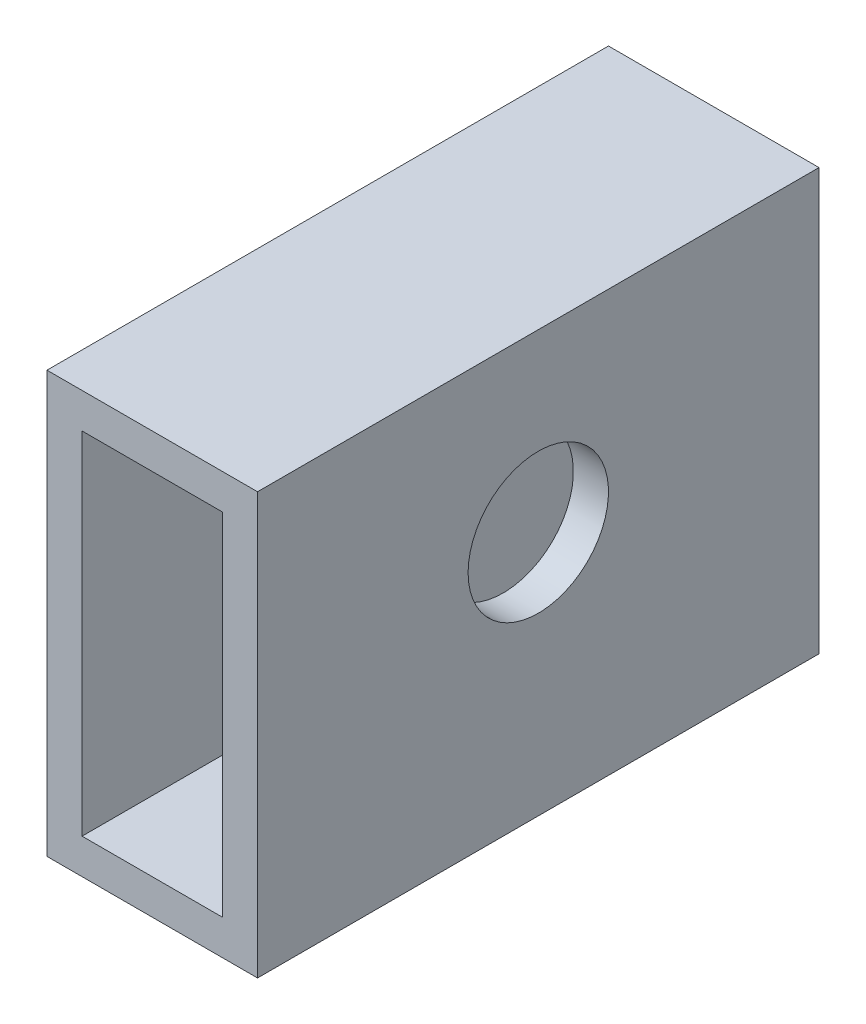
from build123d import *

# Parameters (mm, degrees)
SKETCH1_W           = 19.05
SKETCH1_H           = 38.1
SKETCH1_W_2         = 12.7
SKETCH1_H_2         = 31.75
EXTRUDE_THIN1_DEPTH = 50.8
SKETCH3_R           = 6.35
CUT_EXTRUDE2_DEPTH  = 67.295946332


with BuildPart() as part:
    # Sketch1 → Extrude-Thin1 (new body)
    with BuildSketch(Plane.XY):
        with Locations((9.525, 19.05)):
            Rectangle(SKETCH1_W, SKETCH1_H)
        with Locations((9.525, 19.05)):
            Rectangle(SKETCH1_W_2, SKETCH1_H_2, mode=Mode.SUBTRACT)
    extrude(amount=EXTRUDE_THIN1_DEPTH)

    # Sketch3 → Cut-Extrude2 (cut, through all)
    with BuildSketch(Plane.ZY):
        with Locations((25.4, 22.225)):
            Circle(SKETCH3_R)
    extrude(amount=-CUT_EXTRUDE2_DEPTH, mode=Mode.SUBTRACT)


solid = part.part
